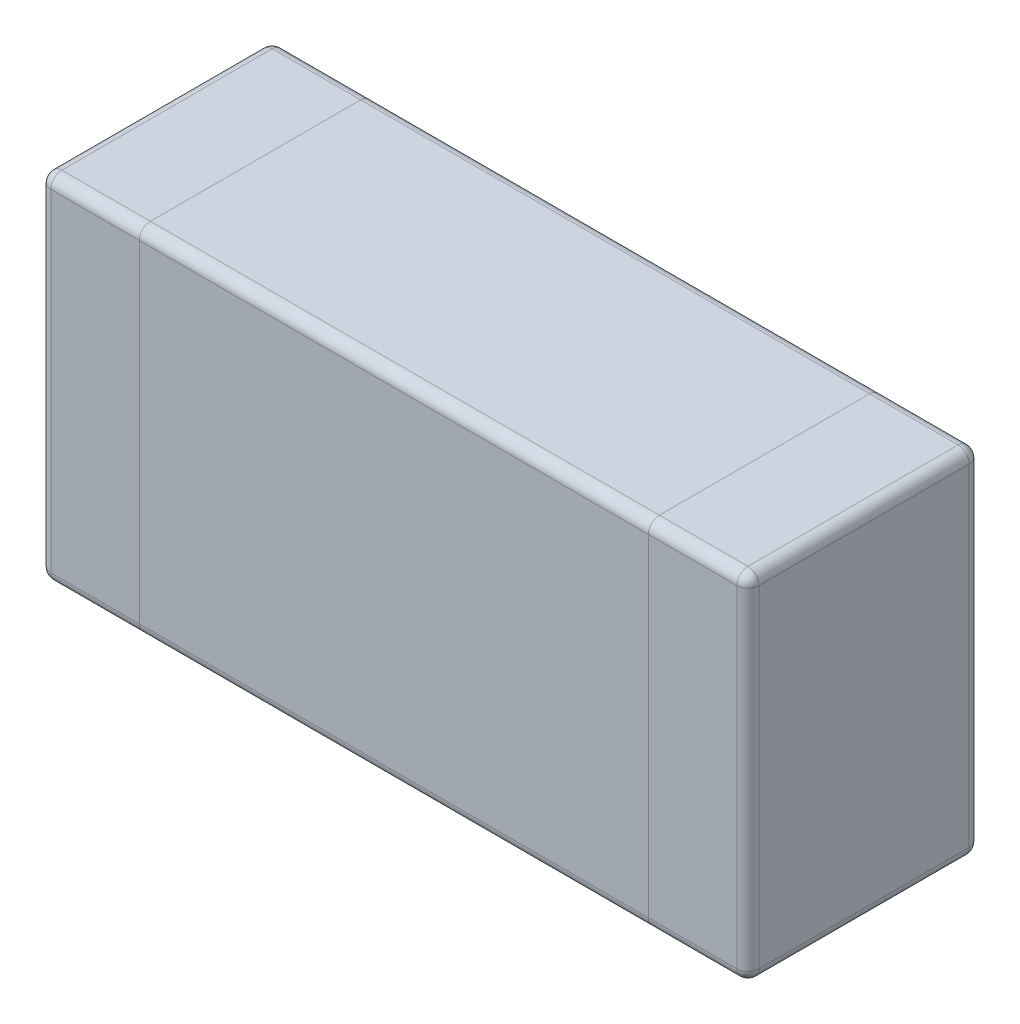
from build123d import *

# Parameters (mm, degrees)
SKETCH1_W                          = 3.2
SKETCH1_H                          = 1.6
EXTRUDE1_DEPTH                     = 1.05
FILLET1_R                          = 0.05
K_RPER_VERSCHIEBEN_KOPIEREN1_ANGLE = 90


with BuildPart() as part:
    # Sketch1 → Extrude1 (new body)
    with BuildSketch(Plane(origin=(0, 0, 0), x_dir=(1, 0, 0), z_dir=(0, 1, 0))):
        Rectangle(SKETCH1_W, SKETCH1_H)
    extrude(amount=EXTRUDE1_DEPTH)

    # Fillet1
    fillet1_edges = [part.edges().sort_by_distance(p)[0] for p in [
        (-1.6, 1.05, 0),
        (0, 1.05, 0.8),
        (1.6, 1.05, 0),
        (0, 0, 0.8),
        (-1.6, 0, 0),
        (0, 0, -0.8),
        (1.6, 0, 0),
        (0, 1.05, -0.8),
        (1.6, 0.525, 0.8),
        (-1.6, 0.525, 0.8),
        (-1.6, 0.525, -0.8),
        (1.6, 0.525, -0.8),
    ]]
    fillet(fillet1_edges, radius=FILLET1_R)


with BuildPart() as part_1:
    # Körper-Verschieben/Kopieren1: moved
    add(part.part.rotate(Axis((0, 0, 0), (1, 0, 0)), K_RPER_VERSCHIEBEN_KOPIEREN1_ANGLE))


solid = part_1.part
